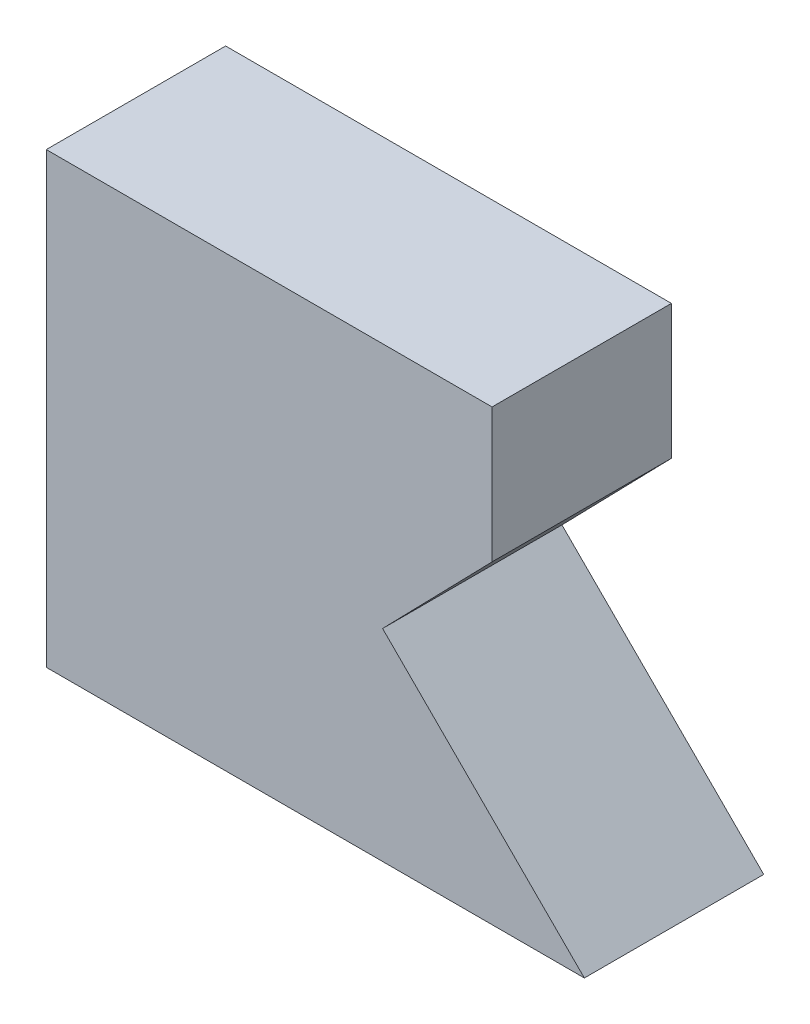
from build123d import *

# Parameters (mm, degrees)
BOSS_EXTRU_1_DEPTH = 40


with BuildPart() as part:
    # Esquisse1 → Boss.-Extru.1 (new body)
    with BuildSketch(Plane.XY):
        Polygon((-60, 0), (60, 0), (15, 45), (39.41665745, 70.076419979), (39.41665745, 100), (-60, 100), align=None)
    extrude(amount=BOSS_EXTRU_1_DEPTH)


solid = part.part
